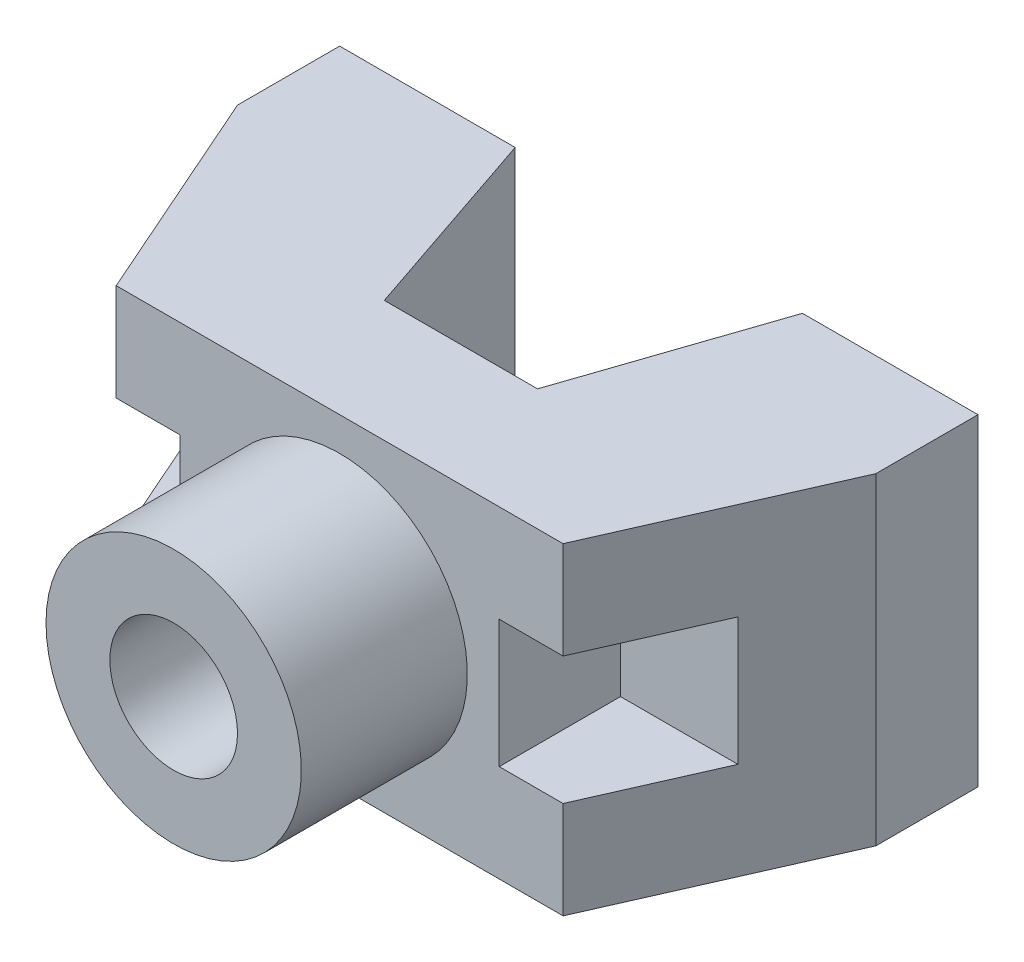
from build123d import *

# Parameters (mm, degrees)
BOSS_EXTRUDE3_DEPTH = 50.5
SKETCH6_R           = 20
BOSS_EXTRUDE4_DEPTH = 26
SKETCH7_R           = 10
CUT_EXTRUDE1_DEPTH  = 26
CUT_EXTRUDE2_DEPTH  = 19


with BuildPart() as part:
    # Sketch4 → Boss-Extrude3 (new body)
    with BuildSketch(Plane(origin=(0, 0, 0), x_dir=(1, 0, 0), z_dir=(0, 1, 0))):
        Polygon((0, 0), (70, 0), (85, 34), (85, 50), (57.5, 50), (47, 19), (23, 19), (12.5, 50), (-15, 50), (-15, 34), align=None)
    extrude(amount=BOSS_EXTRUDE3_DEPTH)

    # Sketch6 → Boss-Extrude4 (add)
    with BuildSketch(Plane.XY):
        with Locations(Location((35, 25.25, 0), (0, 0, 180))):
            Circle(SKETCH6_R)
    extrude(amount=BOSS_EXTRUDE4_DEPTH)

    # Sketch7 → Cut-Extrude1 (cut)
    with BuildSketch(Plane.XY.offset(26)):
        with Locations((35, 25.25)):
            Circle(SKETCH7_R)
    extrude(amount=-CUT_EXTRUDE1_DEPTH, mode=Mode.SUBTRACT)

    # Sketch8 → Cut-Extrude2 (cut)
    with BuildSketch(Plane.XY):
        Polygon((80, 25.855466689), (80, 35.25), (60, 35.25), (60, 15.25), (80, 15.25), align=None)
        Polygon((-10, 25.855466689), (-10, 35.25), (10, 35.25), (10, 15.25), (-10, 15.25), align=None)
    extrude(amount=-CUT_EXTRUDE2_DEPTH, mode=Mode.SUBTRACT)


solid = part.part
